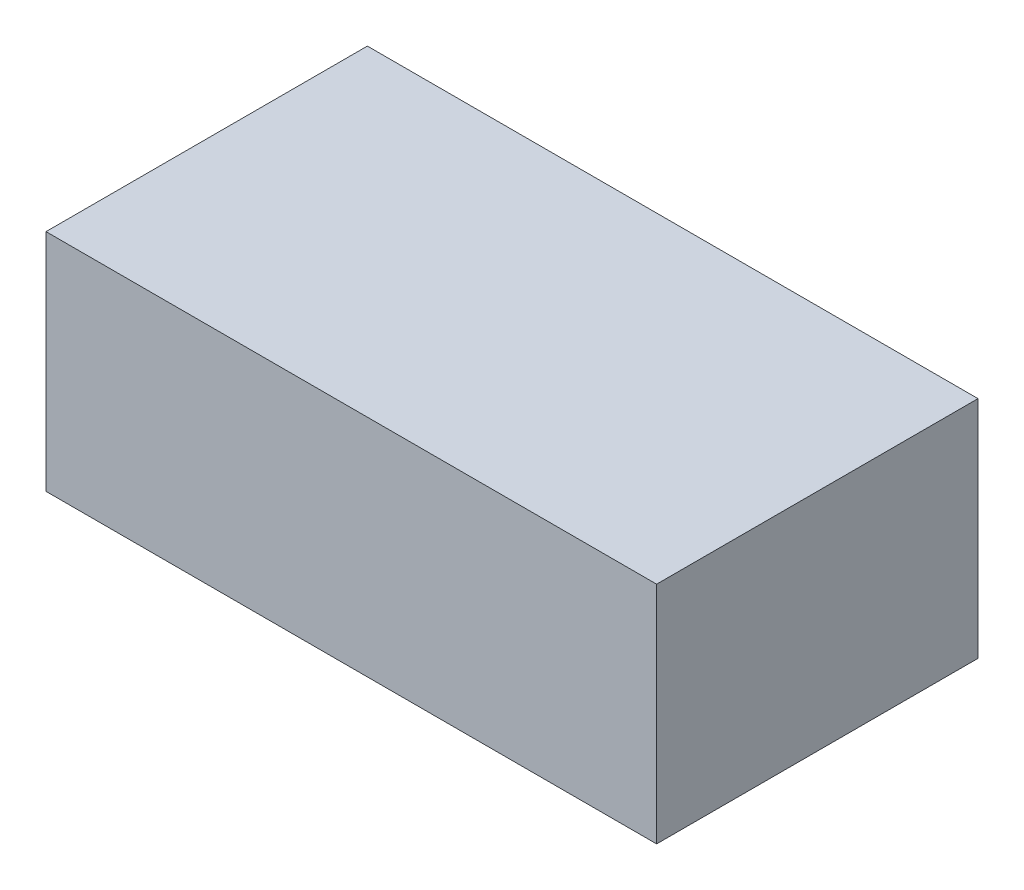
from build123d import *

# Parameters (mm, degrees)
SKETCH1_W           = 48.26
SKETCH1_H           = 25.4
BOSS_EXTRUDE1_DEPTH = 17.78


with BuildPart() as part:
    # Sketch1 → Boss-Extrude1 (new body)
    with BuildSketch(Plane(origin=(0, 0, 0), x_dir=(1, 0, 0), z_dir=(0, 1, 0))):
        Rectangle(SKETCH1_W, SKETCH1_H)
    extrude(amount=BOSS_EXTRUDE1_DEPTH)


solid = part.part
